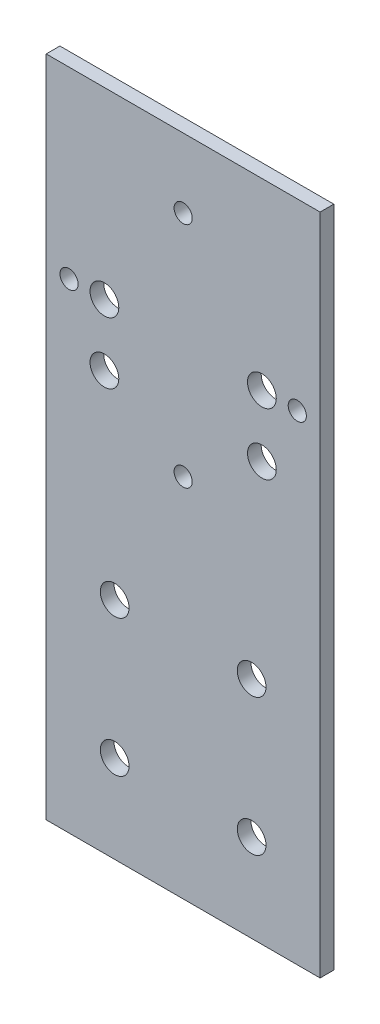
from build123d import *

# Parameters (mm, degrees)
SKETCH1_W            = 80
SKETCH1_H            = 193.756044748
BOSS_EXTRUDE1_DEPTH  = 4
M8_CLEARANCE_HOLE1_D = 8.4
M5_CLEARANCE_HOLE1_D = 5.3


with BuildPart() as part:
    # Sketch1 → Boss-Extrude1 (new body)
    with BuildSketch(Plane.XY):
        with Locations((1780.42117355, -1810.70620503)):
            Rectangle(SKETCH1_W, SKETCH1_H)
    extrude(amount=BOSS_EXTRUDE1_DEPTH)

    # M8 Clearance Hole1 (through all)
    with Locations(Plane.XY.offset(4)):
        with Locations((1757.421173548, -1767.419409116), (1803.421173548, -1767.419409116), (1803.421173548, -1785.419409116), (1757.421173548, -1785.419409116), (1800.42117355, -1841.919409116), (1760.42117355, -1841.919409116), (1800.42117355, -1881.919409116), (1760.42117355, -1881.919409116)):
            Hole(M8_CLEARANCE_HOLE1_D / 2)

    # M5 Clearance Hole1 (through all)
    with Locations(Plane.XY.offset(4)):
        with Locations((1813.754187213, -1767.419409116), (1747.088159883, -1767.419409116), (1780.421173548, -1734.086395451), (1780.421173548, -1800.752422781)):
            Hole(M5_CLEARANCE_HOLE1_D / 2)


solid = part.part
